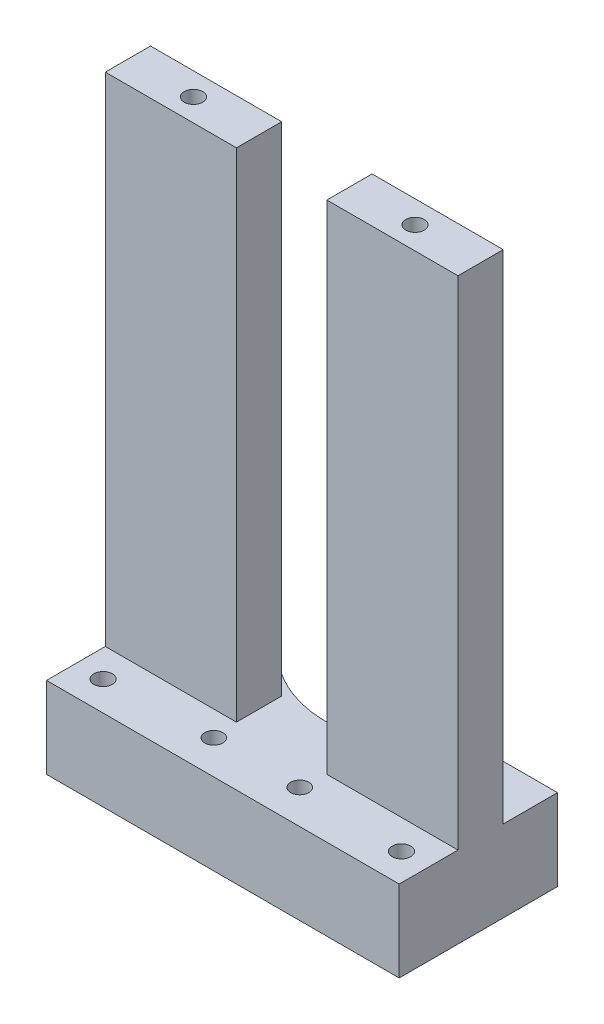
from build123d import *

# Parameters (mm, degrees)
IZIM1_R                     = 2
Y_KSEKLIK_EKSTR_ZYON1_DEPTH = 18
IZIM2_W                     = 29
IZIM2_H                     = 10
Y_KSEKLIK_EKSTR_ZYON2_DEPTH = 110
IZIM3_R                     = 2.05
KES_EKSTR_ZYON1_DEPTH       = 6
IZIM4_R                     = 2.05
KES_EKSTR_ZYON2_DEPTH       = 30
IZIM5_W                     = 6
IZIM5_H                     = 3
KES_EKSTR_ZYON3_DEPTH       = 9


with BuildPart() as part:
    # Çizim1 → Yükseklik-Ekstrüzyon1 (new body)
    with BuildSketch(Plane(origin=(0, 0, 0), x_dir=(1, 0, 0), z_dir=(0, 1, 0))):
        with BuildLine():
            Line((-39, 15), (-22, 15))
            ThreePointArc((-22, 15), (0, 3), (22, 15))
            Line((22, 15), (39, 15))
            Line((39, 15), (39, -20))
            Line((39, -20), (-39, -20))
            Line((-39, -20), (-39, 15))
        make_face()
        with Locations(Location((-29, 8, 0), (0, 0, 270))):
            Circle(IZIM1_R, mode=Mode.SUBTRACT)
        with Locations(Location((29, 8, 0), (0, 0, 270))):
            Circle(IZIM1_R, mode=Mode.SUBTRACT)
        with Locations(Location((-9.5, -12.5, 0), (0, 0, 270))):
            Circle(IZIM1_R, mode=Mode.SUBTRACT)
        with Locations(Location((9.5, -12.5, 0), (0, 0, 270))):
            Circle(IZIM1_R, mode=Mode.SUBTRACT)
    extrude(amount=Y_KSEKLIK_EKSTR_ZYON1_DEPTH)

    # Çizim2 → Yükseklik-Ekstrüzyon2 (add)
    with BuildSketch(Plane(origin=(0, 18, 0), x_dir=(1, 0, 0), z_dir=(0, 1, 0))):
        with Locations((-24.5, -2)):
            Rectangle(IZIM2_W, IZIM2_H)
        with Locations((24.5, -2)):
            Rectangle(IZIM2_W, IZIM2_H)
    extrude(amount=Y_KSEKLIK_EKSTR_ZYON2_DEPTH)

    # Çizim3 → Kes-Ekstrüzyon1 (cut)
    with BuildSketch(Plane(origin=(0, 18, 0), x_dir=(1, 0, 0), z_dir=(0, 1, 0))):
        with Locations(Location((-33, -13.5, 0), (0, 0, 270))):
            Circle(IZIM3_R)
        with Locations(Location((33, -13.5, 0), (0, 0, 90))):
            Circle(IZIM3_R)
    extrude(amount=-KES_EKSTR_ZYON1_DEPTH, mode=Mode.SUBTRACT)

    # Çizim4 → Kes-Ekstrüzyon2 (cut)
    with BuildSketch(Plane(origin=(0, 128, 0), x_dir=(1, 0, 0), z_dir=(0, 1, 0))):
        with Locations(Location((-24.5, -2, 0), (0, 0, 270))):
            Circle(IZIM4_R)
        with Locations(Location((24.5, -2, 0), (0, 0, 90))):
            Circle(IZIM4_R)
    extrude(amount=-KES_EKSTR_ZYON2_DEPTH, mode=Mode.SUBTRACT)

    # Çizim5 → Kes-Ekstrüzyon3 (cut)
    with BuildSketch(Plane(origin=(0, 0, -3), x_dir=(-1, 0, 0), z_dir=(0, 0, -1))):
        with Locations((24.5, 108)):
            Rectangle(IZIM5_W, IZIM5_H)
        with Locations((-24.5, 108)):
            Rectangle(IZIM5_W, IZIM5_H)
    extrude(amount=-KES_EKSTR_ZYON3_DEPTH, mode=Mode.SUBTRACT)


solid = part.part
